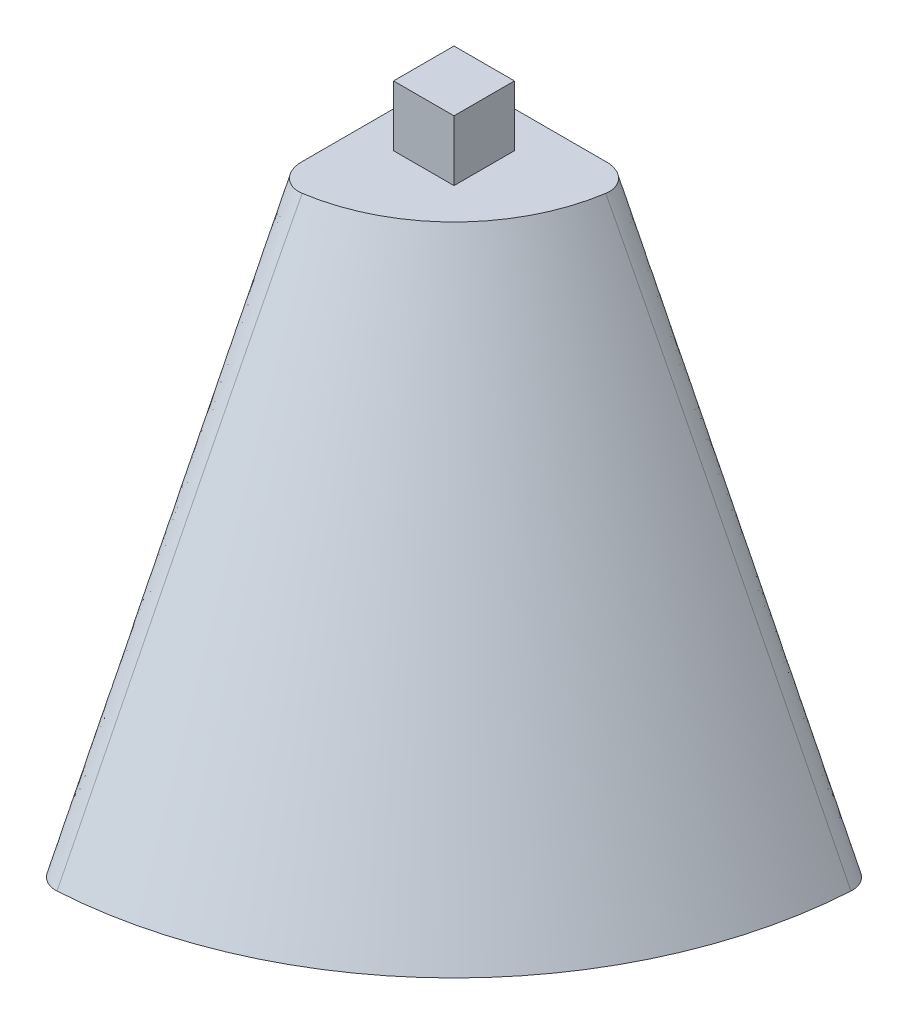
from build123d import *

# Parameters (mm, degrees)
REVOLVE1_ANGLE      = 90
FILLET2_R           = 2
FILLET3_R           = 2
FILLET4_R           = 3
SKETCH2_W           = 5
SKETCH2_H           = 5
BOSS_EXTRUDE1_DEPTH = 5


with BuildPart() as part:
    # Sketch1 → Revolve1 (revolve)
    with BuildSketch(Plane.XY):
        Polygon((0, 0), (15, 0), (35, -40), (0, -40), align=None)
    revolve(axis=Axis((0, 0, 0), (0, -1, 0)), revolution_arc=REVOLVE1_ANGLE)

    # Fillet2
    fillet2_edges = [part.edges().sort_by_distance(p)[0] for p in [
        (0, -20, 25),
    ]]
    fillet(fillet2_edges, radius=FILLET2_R)

    # Fillet3
    fillet3_edges = [part.edges().sort_by_distance(p)[0] for p in [
        (25, -20, 0),
    ]]
    fillet(fillet3_edges, radius=FILLET3_R)

    # Fillet4
    fillet4_edges = [part.edges().sort_by_distance(p)[0] for p in [
        (0, -20, 0),
    ]]
    fillet(fillet4_edges, radius=FILLET4_R)

    # Sketch2 → Boss-Extrude1 (add)
    with BuildSketch(Plane(origin=(0, 0, 0), x_dir=(1, 0, 0), z_dir=(0, 1, 0))):
        with Locations((5.5, -5.5)):
            Rectangle(SKETCH2_W, SKETCH2_H)
    extrude(amount=BOSS_EXTRUDE1_DEPTH)


solid = part.part
